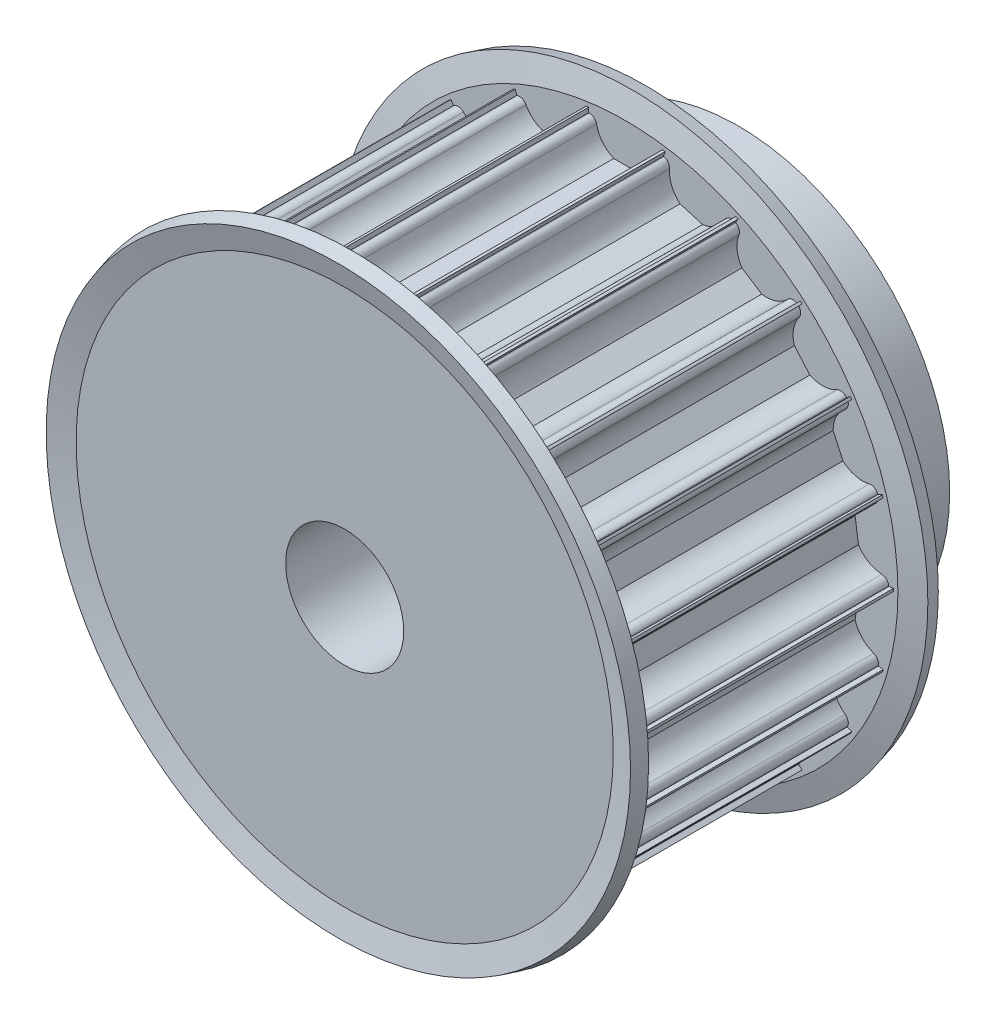
from build123d import *

# Parameters (mm, degrees)
CUT_EXTRUDE1_REACH = 57.544
CIRPATTERN1_COUNT  = 22


with BuildPart() as part:
    # Sketch1 → Revolve1 (revolve)
    with BuildSketch(Plane(origin=(0, 0, 0), x_dir=(0, 0, -1), z_dir=(1, 0, 0)), mode=Mode.PRIVATE) as revolve1_sk:
        Polygon((0, 6), (0, 27.25), (30, 27.25), (30, 21.5), (40, 21.5), (40, 6), align=None)
    revolve(revolve1_sk.sketch.rotate(Axis((0, 0, 0), (0, 0, -1)), 90), axis=Axis((0, 0, 0), (0, 0, -1)))

    # Sketch2 → Cut-Extrude1 (cut, up to next)
    with BuildSketch(Plane.XY, mode=Mode.PRIVATE) as cut_extrude1_sk1:
        with BuildLine():
            Line((-3.674234614, 26.5), (-3.75, 26.5))
            Line((-3.75, 26.5), (-3.75, 28.5))
            Line((-3.75, 28.5), (3.75, 28.5))
            Line((3.75, 28.5), (3.75, 26.5))
            Line((3.75, 26.5), (3.674234614, 26.5))
            ThreePointArc((3.674234614, 26.5), (3.199892965, 26.330947502), (2.939387691, 25.9))
            ThreePointArc((2.939387691, 25.9), (2.331759211, 24.612435701), (1.198957881, 23.75))
            Line((1.198957881, 23.75), (-1.198957881, 23.75))
            ThreePointArc((-1.198957881, 23.75), (-2.331759211, 24.612435701), (-2.939387691, 25.9))
            ThreePointArc((-2.939387691, 25.9), (-3.199892965, 26.330947502), (-3.674234614, 26.5))
        make_face()
    cut_extrude1_tool1 = extrude(cut_extrude1_sk1.sketch, amount=-CUT_EXTRUDE1_REACH, mode=Mode.PRIVATE) & part.part
    cut_extrude1 = cut_extrude1_tool1.solids().sort_by_distance((0, 26.435169, 0))[0]
    add(cut_extrude1, mode=Mode.SUBTRACT)

    # CirPattern1: Cut-Extrude1 ×22 about axis
    cirpattern1_axis = Axis((0, 0, 0), (0, 0, 1))
    for i in range(1, CIRPATTERN1_COUNT):
        add(cut_extrude1.rotate(cirpattern1_axis, i * 360 / CIRPATTERN1_COUNT), mode=Mode.SUBTRACT)

    # Sketch3 → Revolve2 (revolve)
    with BuildSketch(Plane(origin=(0, 0, 0), x_dir=(0, 0, -1), z_dir=(1, 0, 0)), mode=Mode.PRIVATE) as revolve2_sk:
        Polygon((30, 21.5), (30, 27.301771432), (30.643078062, 29.701771432), (29.194189322, 30.09), (28.551111261, 27.69), (28.551111261, 21.5), align=None)
        Polygon((1.448888739, 21.5), (0, 21.5), (0, 27.301771432), (-0.643078062, 29.701771432), (0.805810678, 30.09), (1.448888739, 27.69), align=None)
    revolve(revolve2_sk.sketch.rotate(Axis((0, 0, 0), (0, 0, -1)), 90), axis=Axis((0, 0, 0), (0, 0, -1)))


solid = part.part
